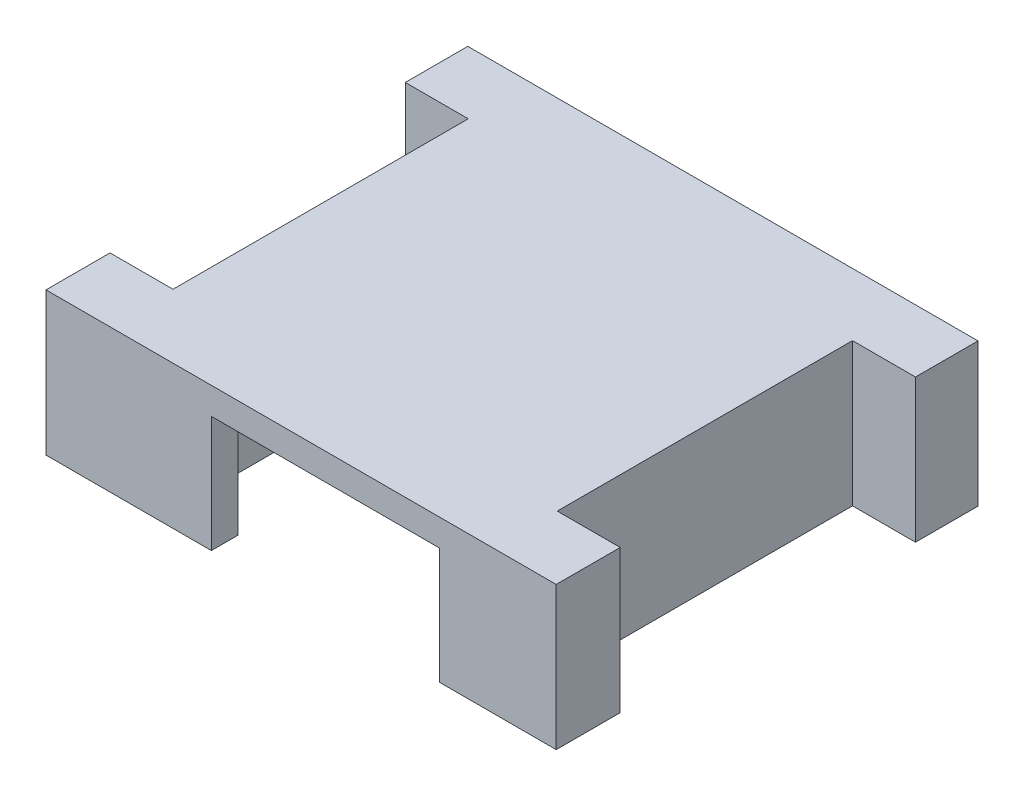
from build123d import *

# Parameters (mm, degrees)
SKETCH1_R             = 1.35
BOSS_EXTRUDE2_DEPTH   = 13
BOSS_EXTRUDE2_2_DEPTH = 13
SKETCH4_R             = 1.35
BOSS_EXTRUDE5_DEPTH   = 3


with BuildPart() as part:
    # Sketch1 → Boss-Extrude2 (new body)
    with BuildSketch(Plane(origin=(0, 0, 0), x_dir=(1, 0, 0), z_dir=(0, 1, 0))):
        Polygon((-11.255, 23.58), (-29.745, 23.58), (-29.745, 16.589209278), (-22.7039371, 16.589209278), (-22.7039371, -16.42), (-29.745, -16.42), (-29.745, -23.58), (-11.255, -23.58), (-11.255, -20.58), (-17.255, -20.58), (-17.255, 20.58), (-11.255, 20.58), align=None)
        with Locations(Location((-26.22446855, 20.084604639, 0), (0, 0, 90))):
            Circle(SKETCH1_R, mode=Mode.SUBTRACT)
        with Locations(Location((-26.22446855, -19.915395361, 0), (0, 0, 90))):
            Circle(SKETCH1_R, mode=Mode.SUBTRACT)
    extrude(amount=BOSS_EXTRUDE2_DEPTH)



with BuildPart() as body_2:
    # Sketch1 → Boss-Extrude2 2 (new body)
    with BuildSketch(Plane(origin=(0, 0, 0), x_dir=(1, 0, 0), z_dir=(0, 1, 0))):
        Polygon((14.255, 23.58), (14.255, 20.58), (17.255, 20.58), (17.255, -20.58), (14.255, -20.58), (14.255, -23.58), (27.2960629, -23.58), (27.2960629, -16.42), (20.255, -16.42), (20.255, 16.589209278), (27.2960629, 16.589209278), (27.2960629, 23.58), align=None)
        with Locations(Location((23.77553145, 20.084604639, 0), (0, 0, 90))):
            Circle(SKETCH1_R, mode=Mode.SUBTRACT)
        with Locations(Location((23.77553145, -19.915395361, 0), (0, 0, 90))):
            Circle(SKETCH1_R, mode=Mode.SUBTRACT)
    extrude(amount=BOSS_EXTRUDE2_2_DEPTH)


with BuildPart() as part_1:
    add(part.part)

    add(body_2.part)  # Boss-Extrude5 merges body 2
    # Sketch4 → Boss-Extrude5 (add)
    # profile 1 of 4: a face of its own
    with BuildSketch(Plane(origin=(0, 13, 0), x_dir=(1, 0, 0), z_dir=(0, 1, 0))):
        Polygon((-29.745, -23.58), (-11.255, -23.58), (-11.255, -20.58), (-17.255, -20.58), (-17.255, 20.58), (-11.255, 20.58), (-11.255, 23.58), (-29.745, 23.58), (-29.745, 16.589209278), (-22.7039371, 16.589209278), (-22.7039371, -16.42), (-29.745, -16.42), align=None)
        with Locations(Location((-26.22446855, -19.915395361, 0), (0, 0, 90))):
            Circle(SKETCH4_R, mode=Mode.SUBTRACT)
        with Locations(Location((-26.22446855, 20.084604639, 0), (0, 0, 90))):
            Circle(SKETCH4_R, mode=Mode.SUBTRACT)
    # profile 2 of 4: a face of its own
    with BuildSketch(Plane(origin=(0, 13, 0), x_dir=(1, 0, 0), z_dir=(0, 1, 0))):
        Polygon((27.2960629, 23.58), (-11.255, 23.58), (-11.255, 20.58), (-17.255, 20.58), (-17.255, -20.58), (-11.255, -20.58), (-11.255, -23.58), (27.2960629, -23.58), (27.2960629, -16.42), (20.255, -16.42), (20.255, 16.589209278), (27.2960629, 16.589209278), align=None)
    # profile 3 of 4: a face of its own
    with BuildSketch(Plane(origin=(0, 13, 0), x_dir=(1, 0, 0), z_dir=(0, 1, 0))):
        with Locations(Location((-26.22446855, 20.084604639, 0), (0, 0, 90))):
            Circle(SKETCH4_R)
    # profile 4 of 4: a face of its own
    with BuildSketch(Plane(origin=(0, 13, 0), x_dir=(1, 0, 0), z_dir=(0, 1, 0))):
        with Locations(Location((-26.22446855, -19.915395361, 0), (0, 0, 90))):
            Circle(SKETCH4_R)
    extrude(amount=BOSS_EXTRUDE5_DEPTH)


solid = part_1.part
